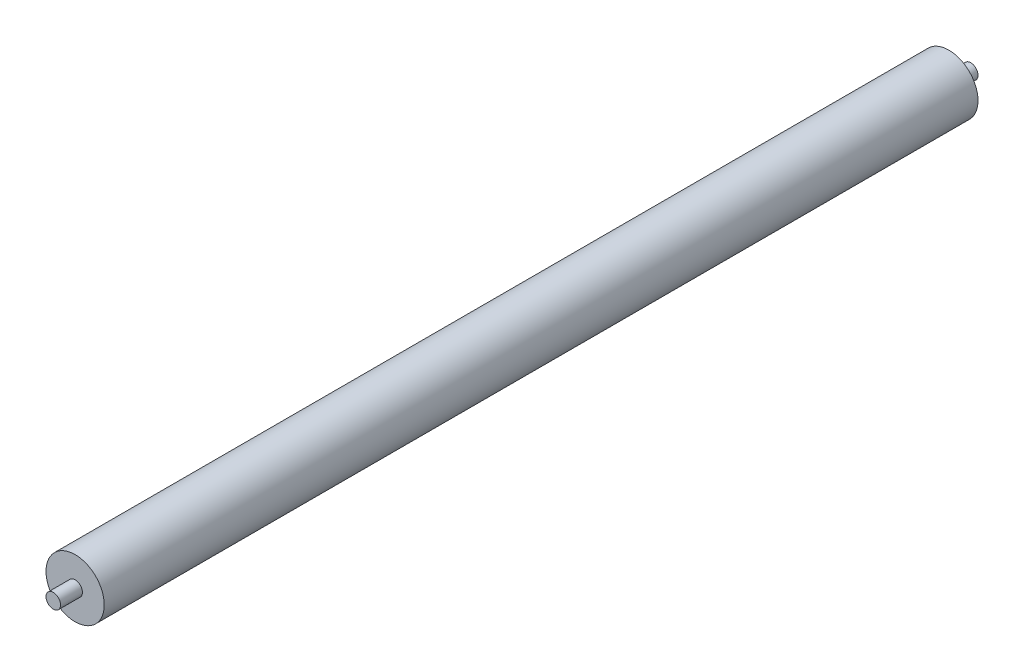
from build123d import *

# Parameters (mm, degrees)
SKETCH1_R           = 6.35
BOSS_EXTRUDE1_DEPTH = 400.05
SKETCH1_3_R         = 25.4
SKETCH1_3_R_2       = 6.35
BOSS_EXTRUDE2_DEPTH = 381


with BuildPart() as part:
    # Sketch1 → Boss-Extrude1 (new, symmetric)
    with BuildSketch(Plane.XY):
        Circle(SKETCH1_R)
    extrude(amount=BOSS_EXTRUDE1_DEPTH, both=True)

    # Sketch1<3> → Boss-Extrude2 (add, symmetric)
    with BuildSketch(Plane.XY):
        Circle(SKETCH1_3_R)
        Circle(SKETCH1_3_R_2, mode=Mode.SUBTRACT)
    extrude(amount=BOSS_EXTRUDE2_DEPTH, both=True)


solid = part.part
